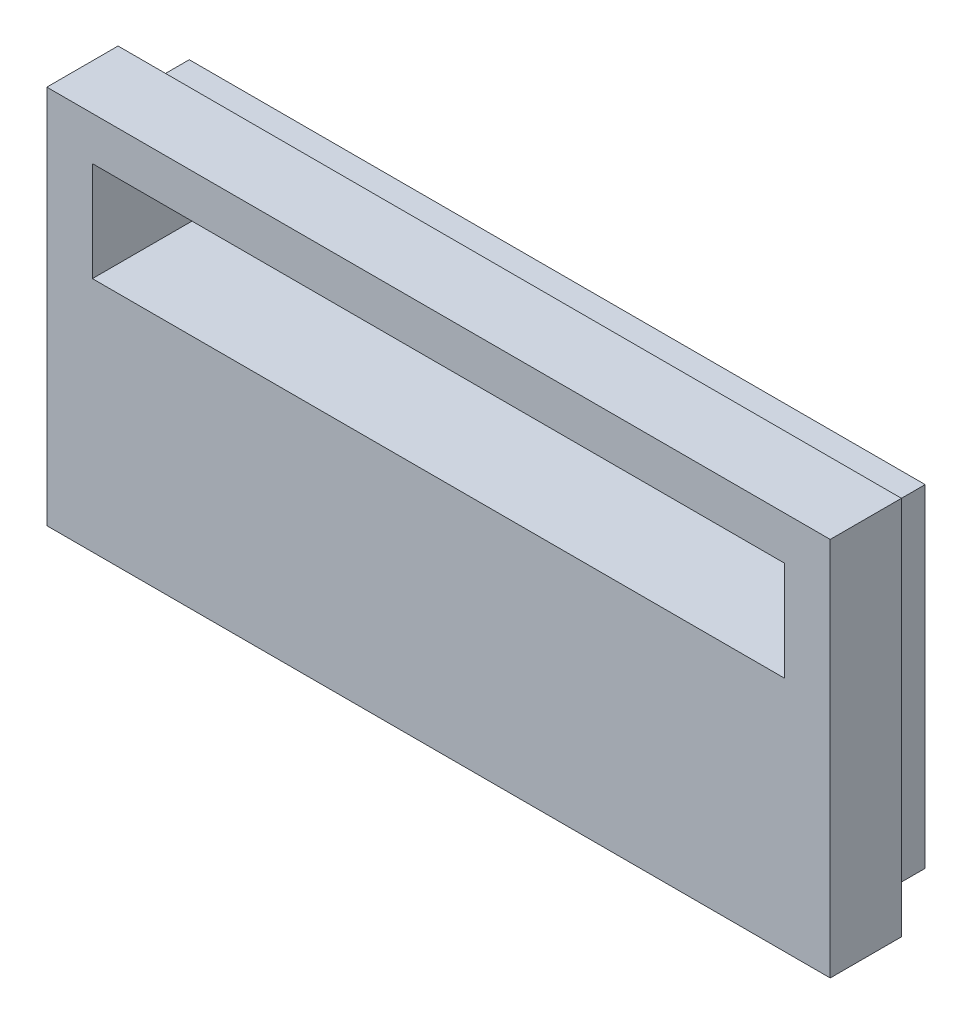
from build123d import *

# Parameters (mm, degrees)
SKETCH1_W           = 16.5
SKETCH1_H           = 8
BOSS_EXTRUDE1_DEPTH = 1.5
SKETCH2_W           = 15.5
SKETCH2_H           = 7
BOSS_EXTRUDE2_DEPTH = 1
SKETCH3_W           = 14.580207812
SKETCH3_H           = 2.098127465
CUT_EXTRUDE2_DEPTH  = 5


with BuildPart() as part:
    # Sketch1 → Boss-Extrude1 (new body)
    with BuildSketch(Plane.XY):
        Rectangle(SKETCH1_W, SKETCH1_H)
    extrude(amount=BOSS_EXTRUDE1_DEPTH)

    # Sketch2 → Boss-Extrude2 (add)
    with BuildSketch(Plane(origin=(0, 0, 0), x_dir=(-1, 0, 0), z_dir=(0, 0, -1))):
        Rectangle(SKETCH2_W, SKETCH2_H)
    extrude(amount=BOSS_EXTRUDE2_DEPTH)

    # Sketch3 → Cut-Extrude2 (cut)
    with BuildSketch(Plane(origin=(0, 0, -1), x_dir=(-1, 0, 0), z_dir=(0, 0, -1))):
        with Locations((0, 2.035894872)):
            Rectangle(SKETCH3_W, SKETCH3_H)
    extrude(amount=-CUT_EXTRUDE2_DEPTH, mode=Mode.SUBTRACT)


solid = part.part
